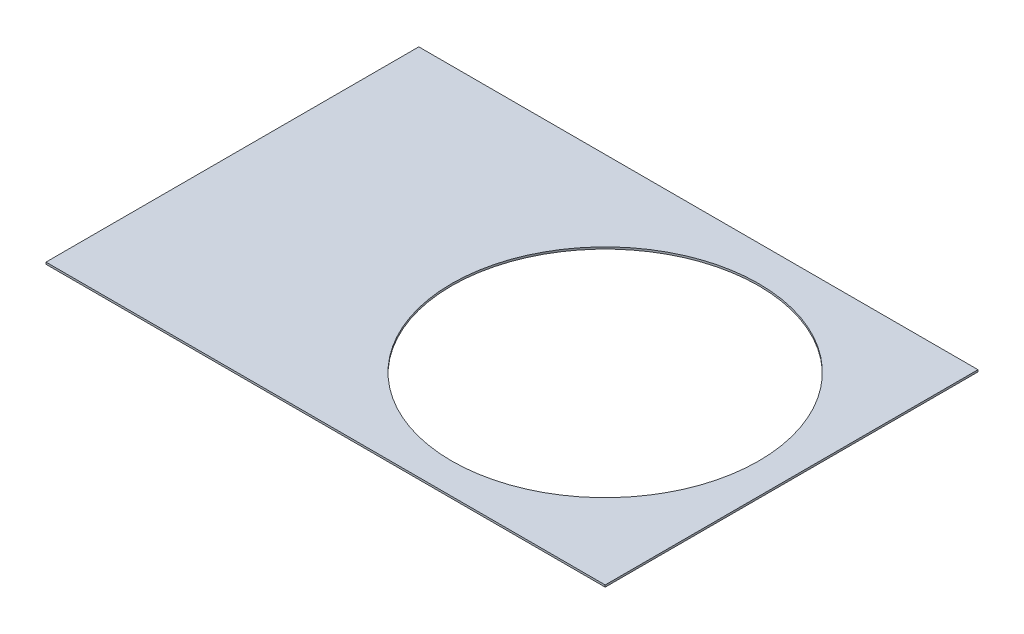
from build123d import *

# Parameters (mm, degrees)
SKETCH1_W           = 914.4
SKETCH1_H           = 609.6
SKETCH1_R           = 251.150820843
BOSS_EXTRUDE1_DEPTH = 3.175


with BuildPart() as part:
    # Sketch1 → Boss-Extrude1 (new body)
    with BuildSketch(Plane(origin=(0, 0, 0), x_dir=(1, 0, 0), z_dir=(0, 1, 0))):
        Rectangle(SKETCH1_W, SKETCH1_H)
        with Locations(Location((156.049179157, -3.649179157, 0), (0, 0, 270))):
            Circle(SKETCH1_R, mode=Mode.SUBTRACT)
    extrude(amount=BOSS_EXTRUDE1_DEPTH)


solid = part.part
